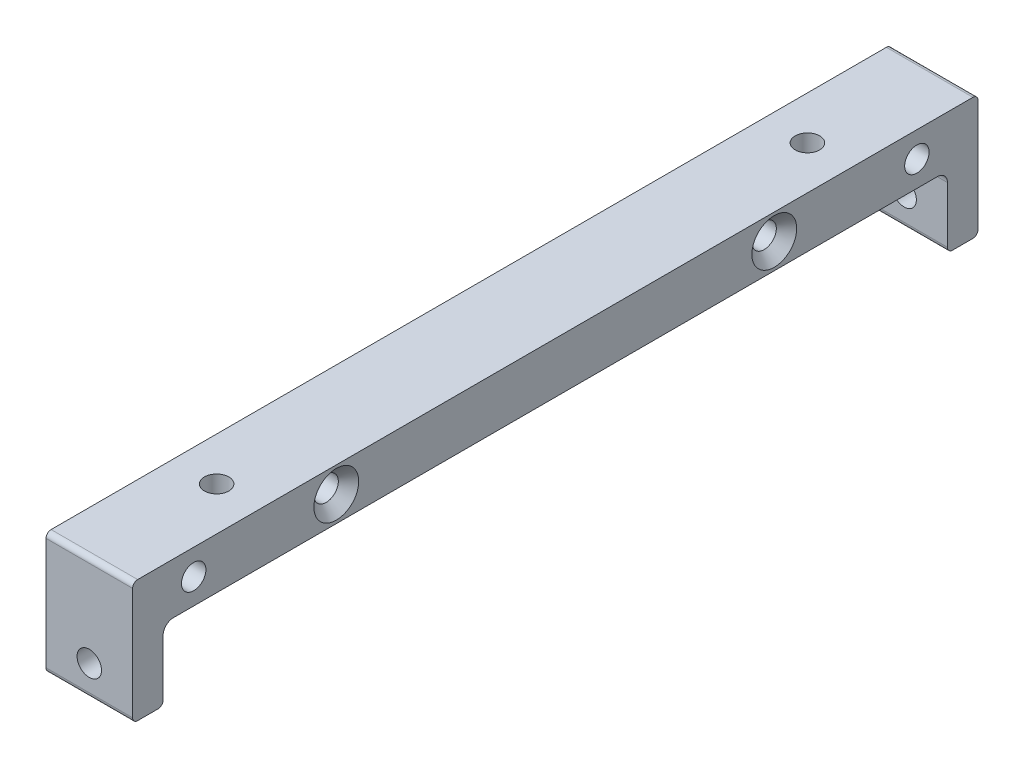
from build123d import *

# Parameters (mm, degrees)
SKETCH1_W              = 8.5
SKETCH1_H              = 12
BOSS_EXTRUDE1_DEPTH    = 41.5
CUT_EXTRUDE1_DEPTH     = 43.784342931
FILLET1_R              = 0.5
M2_HOLE1_J_D           = 2.4
M2_HOLE1_J_DEPTH       = 5
M2_HOLE1_J_TIP         = 0.721032743
M2_HOLE2_K_D           = 2.4
M2_HOLE2_K_CSINK_D     = 4.4
M2_HOLE2_K_CSINK_ANGLE = 90
M2_HOLE3_L_D           = 2.4
M2_HOLE3_L_DEPTH       = 10
M2_HOLE3_L_TIP         = 0.721032743
M2_HOLE4_M_D           = 2.4
M2_HOLE5_N_D           = 2.4
M2_HOLE5_N_DEPTH       = 4
M2_HOLE5_N_TIP         = 0.721032743
M2_HOLE6_P_D           = 2.4
M2_HOLE6_P_DEPTH       = 10
M2_HOLE6_P_TIP         = 0.721032743


with BuildPart() as part:
    # Sketch1 → Boss-Extrude1 (new, symmetric)
    with BuildSketch(Plane.XY):
        Rectangle(SKETCH1_W, SKETCH1_H)
    extrude(amount=BOSS_EXTRUDE1_DEPTH, both=True)

    # Sketch2 → Cut-Extrude1 (cut, through all)
    with BuildSketch(Plane(origin=(4.25, 0, 0), x_dir=(0, 0, -1), z_dir=(1, 0, 0))):
        with BuildLine():
            Line((-37.5, 1), (37.5, 1))
            ThreePointArc((37.5, 1), (38.207106781, 0.707106781), (38.5, 0))
            Line((38.5, 0), (38.5, -6))
            Line((38.5, -6), (-38.5, -6))
            Line((-38.5, -6), (-38.5, 0))
            ThreePointArc((-38.5, 0), (-38.207106781, 0.707106781), (-37.5, 1))
        make_face()
    extrude(amount=-CUT_EXTRUDE1_DEPTH, mode=Mode.SUBTRACT)

    # Fillet1
    fillet1_edges = [part.edges().sort_by_distance(p)[0] for p in [
        (0, -6, 41.5),
        (0, -6, -38.5),
        (0, -6, 38.5),
        (0, -6, -41.5),
        (0, 6, -41.5),
        (0, 6, 41.5),
    ]]
    fillet(fillet1_edges, radius=FILLET1_R)

    # M2 Hole1 - J
    with Locations(Plane(origin=(4.25, 0, 0), x_dir=(0, 0, -1), z_dir=(1, 0, 0))):
        with Locations((-35.5, 3.5), (35.5, 3.5)):
            Hole(M2_HOLE1_J_D / 2, depth=M2_HOLE1_J_DEPTH)
            with Locations((0, 0, -(M2_HOLE1_J_DEPTH + M2_HOLE1_J_TIP / 2))):  # 118° drill point
                Cone(0, M2_HOLE1_J_D / 2, M2_HOLE1_J_TIP, mode=Mode.SUBTRACT)

    # M2 Hole2 - K (through all)
    with Locations(Plane(origin=(4.25, 0, 0), x_dir=(0, 0, -1), z_dir=(1, 0, 0))):
        with Locations((-21.5, 3.5), (21.5, 3.5)):
            CounterSinkHole(M2_HOLE2_K_D / 2, M2_HOLE2_K_CSINK_D / 2, counter_sink_angle=M2_HOLE2_K_CSINK_ANGLE)

    # M2 Hole3 - L
    with Locations(Plane.XY.offset(41.5)):
        with Locations((0, -3)):
            Hole(M2_HOLE3_L_D / 2, depth=M2_HOLE3_L_DEPTH)
            with Locations((0, 0, -(M2_HOLE3_L_DEPTH + M2_HOLE3_L_TIP / 2))):  # 118° drill point
                Cone(0, M2_HOLE3_L_D / 2, M2_HOLE3_L_TIP, mode=Mode.SUBTRACT)

    # M2 Hole4 - M (through all)
    with Locations(Plane(origin=(0, 6, 0), x_dir=(1, 0, 0), z_dir=(0, 1, 0))):
        with Locations((0, 29), (0, -29)):
            Hole(M2_HOLE4_M_D / 2)

    # M2 Hole5 - N
    with Locations(Plane.ZY.offset(4.25)):
        with Locations((0, 3.5)):
            Hole(M2_HOLE5_N_D / 2, depth=M2_HOLE5_N_DEPTH)
            with Locations((0, 0, -(M2_HOLE5_N_DEPTH + M2_HOLE5_N_TIP / 2))):  # 118° drill point
                Cone(0, M2_HOLE5_N_D / 2, M2_HOLE5_N_TIP, mode=Mode.SUBTRACT)

    # M2 Hole6 - P
    with Locations(Plane(origin=(0, 0, -41.5), x_dir=(-1, 0, 0), z_dir=(0, 0, -1))):
        with Locations((0, -3)):
            Hole(M2_HOLE6_P_D / 2, depth=M2_HOLE6_P_DEPTH)
            with Locations((0, 0, -(M2_HOLE6_P_DEPTH + M2_HOLE6_P_TIP / 2))):  # 118° drill point
                Cone(0, M2_HOLE6_P_D / 2, M2_HOLE6_P_TIP, mode=Mode.SUBTRACT)


solid = part.part
